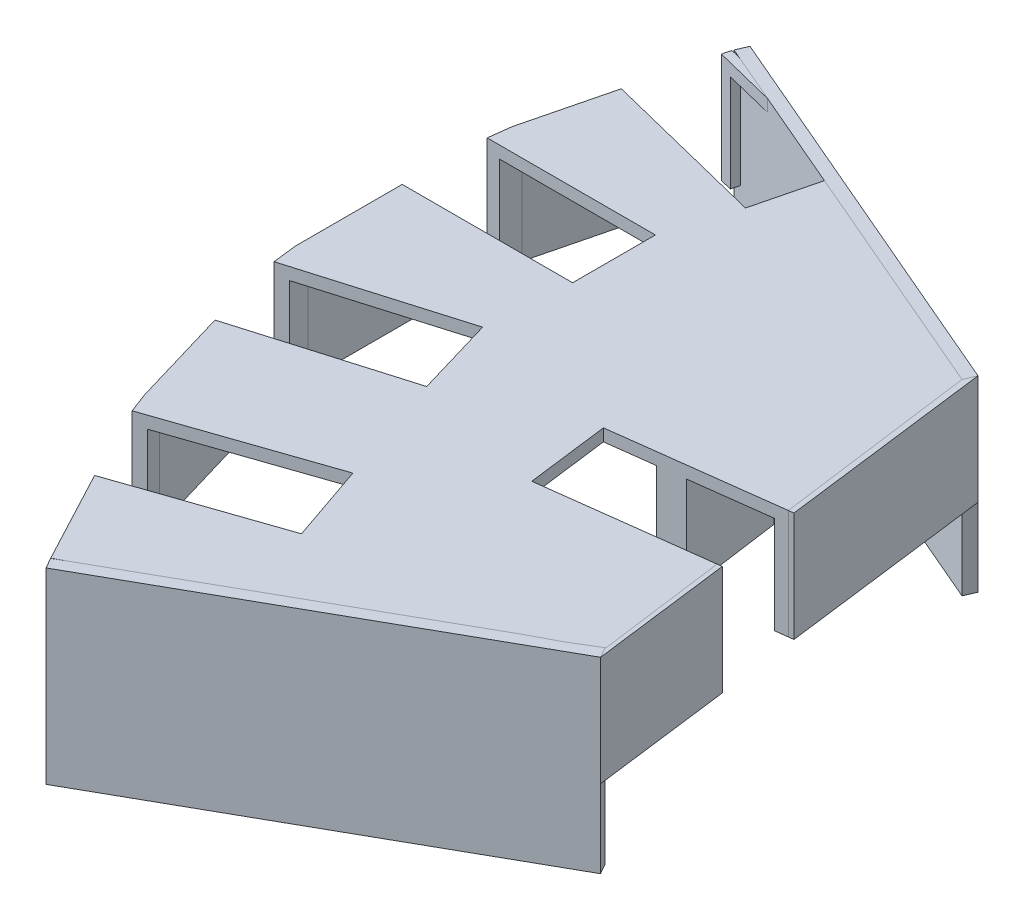
from build123d import *

# Parameters (mm, degrees)
BOSS_EXTRUDE1_DEPTH   = 20
BOSS_EXTRUDE1_2_DEPTH = 20
BOSS_EXTRUDE3_DEPTH   = 2.5
BOSS_EXTRUDE5_DEPTH   = 2.5
BOSS_EXTRUDE7_DEPTH   = 2.5
BOSS_EXTRUDE9_DEPTH   = 22.5
CUT_EXTRUDE1_DEPTH    = 35
CUT_EXTRUDE3_DEPTH    = 35
CUT_EXTRUDE5_DEPTH    = 35
CUT_EXTRUDE7_DEPTH    = 35
CUT_EXTRUDE8_DEPTH    = 35


with BuildPart() as part:
    # Sketch1 → Boss-Extrude1 (new body)
    with BuildSketch(Plane(origin=(0, 0, 0), x_dir=(1, 0, 0), z_dir=(0, 1, 0))):
        Polygon((33.151826981, -28.889539813), (43.532853036, -48.440295537), (55.01986224, -42.340943495), (43.794416361, 42.302390906), (30.631369723, 47.950055803), (24.810262555, 22.924594248), (25.109476408, 19.342716652), (25.112763078, -0.657283348), (25.762252215, -5.365269223), (31.429425892, -24.545549266), align=None)
        Polygon((32.389830977, 44.475185063), (27.334304705, 22.741024409), (43.567457043, 24.997907911), (41.502917609, 40.565173886), align=None, mode=Mode.SUBTRACT)
        Polygon((27.747419084, 19.769604461), (33.794993109, -23.728959096), (35.42478626, -27.839387317), (44.568470816, -45.059837607), (52.313182094, -40.947564368), (43.961873164, 22.023888357), align=None, mode=Mode.SUBTRACT)
    extrude(amount=BOSS_EXTRUDE1_DEPTH)



with BuildPart() as body_2:
    # Sketch1 → Boss-Extrude1 2 (new body)
    with BuildSketch(Plane(origin=(0, 0, 0), x_dir=(1, 0, 0), z_dir=(0, 1, 0))):
        Polygon((-35.959492242, 76.521167337), (-38.385231558, 77.125972076), (-47.373086859, 41.077653402), (-48.397629196, 32.789030369), (-48.391827101, -2.517800327), (-47.399088956, -10.603003688), (-37.394840102, -44.4619086), (-34.498049544, -52.008306004), (-18.012795707, -83.055253493), (-15.804757852, -81.882833418), (-32.218638907, -50.970303455), (-35.02538101, -43.658490296), (-44.942934944, -10.093000221), (-45.891852228, -2.364689129), (-45.897603901, 32.635310398), (-44.910602379, 40.620225465), align=None)
    extrude(amount=BOSS_EXTRUDE1_2_DEPTH)


with BuildPart() as part_1:
    add(part.part)

    add(body_2.part)  # Boss-Extrude3 merges body 2
    # Sketch5 → Boss-Extrude3 (add)
    with BuildSketch(Plane(origin=(0, 20, 0), x_dir=(1, 0, 0), z_dir=(0, 1, 0))):
        with BuildLine():
            Line((-15.804757852, -81.882833418), (43.532853036, -48.440295537))
            Line((43.532853036, -48.440295537), (55.01986224, -42.340943495))
            Line((55.01986224, -42.340943495), (43.794416361, 42.302390906))
            Line((43.794416361, 42.302390906), (30.631369723, 47.950055803))
            Line((30.631369723, 47.950055803), (-35.959492242, 76.521167337))
            ThreePointArc((-35.959492242, 76.521167337), (-37.147972825, 76.921388943), (-38.385231558, 77.125972076))
            Line((-38.385231558, 77.125972076), (-47.373086859, 41.077653402))
            Line((-47.373086859, 41.077653402), (-48.397629196, 32.789030369))
            Line((-48.397629196, 32.789030369), (-48.391827101, -2.517800327))
            Line((-48.391827101, -2.517800327), (-47.399088956, -10.603003688))
            Line((-47.399088956, -10.603003688), (-37.394840102, -44.4619086))
            Line((-37.394840102, -44.4619086), (-34.498049544, -52.008306004))
            Line((-34.498049544, -52.008306004), (-18.012795707, -83.055253493))
            Line((-18.012795707, -83.055253493), (-15.804757852, -81.882833418))
        make_face()
    extrude(amount=BOSS_EXTRUDE3_DEPTH)

    # Sketch9 → Cut-Extrude1 (cut)
    with BuildSketch(Plane(origin=(-42.82190598, 22.5, -75.462856003), x_dir=(0.9988636405139372, 0, -0.047659497051944756), z_dir=(0, 1, 0))):
        Polygon((0.746020724, -124.239988023), (35.312448522, -114.182052387), (40.062029239, -130.505087736), (5.495601441, -140.563023372), align=None)
    extrude(amount=-CUT_EXTRUDE1_DEPTH, mode=Mode.SUBTRACT)

    # Sketch11 → Cut-Extrude3 (cut)
    with BuildSketch(Plane(origin=(-42.82190598, 22.5, -75.462856003), x_dir=(0.9988636405139371, 0, -0.04765949705194475), z_dir=(0, 1, 0))):
        Polygon((-5.396966491, -99.162626381), (28.603046753, -90.856056728), (24.568427207, -74.341764581), (-9.431586037, -82.648334234), align=None)
    extrude(amount=-CUT_EXTRUDE3_DEPTH, mode=Mode.SUBTRACT)

    # Sketch13 → Cut-Extrude5 (cut)
    with BuildSketch(Plane(origin=(-42.82190598, 22.5, -75.462856003), x_dir=(0.9988636405139371, 0, -0.04765949705194475), z_dir=(0, 1, 0))):
        Polygon((-7.42661137, -38.645767828), (27.533889698, -40.308105066), (26.726468754, -57.28891987), (-8.234032314, -55.626582632), align=None)
    extrude(amount=-CUT_EXTRUDE5_DEPTH, mode=Mode.SUBTRACT)

    # Sketch15 → Cut-Extrude7 (cut)
    with BuildSketch(Plane(origin=(-42.82190598, 22.5, -75.462856003), x_dir=(0.9988636405139371, 0, -0.04765949705194475), z_dir=(0, 1, 0))):
        Polygon((4.020110973, -0.182810694), (16.469733166, -3.925390986), (36.510013001, -13.679647293), (32.65940268, -26.488629322), (-0.858810917, -16.412451614), align=None)
    extrude(amount=-CUT_EXTRUDE7_DEPTH, mode=Mode.SUBTRACT)


with BuildPart() as body_2_2:
    # Sketch6 → Boss-Extrude5 (new body)
    with BuildSketch(Plane(origin=(31.213867564, 0, 55.383246764), x_dir=(0.871166636126556, 0, -0.4909874663369126), z_dir=(0.49098746633691265, 0, 0.8711666361265561))):
        Polygon((-53.972022649, 22.5), (14.140791166, 22.5), (27.142595739, 22.5), (27.142595739, 0), (27.142595739, -16), (-56.471235122, -16), (-56.471235122, 0), (-56.471235122, 22.5), align=None)
    extrude(amount=BOSS_EXTRUDE5_DEPTH)


with BuildPart() as body_3:
    # Sketch7 → Boss-Extrude7 (new body)
    with BuildSketch(Plane(origin=(22.136914585, 0, -51.594640331), x_dir=(-0.9189842056612053, 0, -0.3942943440441967), z_dir=(0.3942943440441968, 0, -0.9189842056612054))):
        Polygon((-23.566783458, 0), (-23.566783458, 22.5), (65.685756101, 22.5), (65.685756101, 0), (65.685756101, -16), (-23.566783458, -16), align=None)
    extrude(amount=BOSS_EXTRUDE7_DEPTH)


with BuildPart() as body_4:
    # Sketch8 → Boss-Extrude9 (new body)
    with BuildSketch(Plane.XZ):
        Polygon((56.087060055, 44.234489043), (44.780152221, -44.59985142), (43.794416361, -42.302390906), (55.01986224, 42.340943495), align=None)
    extrude(amount=-BOSS_EXTRUDE9_DEPTH)


with BuildPart() as cut_extrude7_piece_1:
    # of the separate pieces the step leaves, piece 1, a body of its own (cut_extrude7_pieces)
    add(part_1.part.solids().sort_by_distance((33.151826981, 0, 28.889539813))[0])


with BuildPart() as cut_extrude7_piece_2:
    # of the separate pieces the step leaves, piece 2, a body of its own (cut_extrude7_pieces)
    add(part_1.part.solids().sort_by_distance((-36.371911317, 20, -74.867044776))[0])


with BuildPart() as cut_extrude8_tool:
    # Sketch16 → Cut-Extrude8 (new body)
    with BuildSketch(Plane(origin=(-42.82190598, 22.5, -75.462856003), x_dir=(0.9988636405139371, 0, -0.04765949705194475), z_dir=(0, 1, 0))):
        Polygon((54.582299423, -81.281151066), (89.473352578, -78.521729075), (90.81364326, -95.468812036), (55.922590105, -98.228234027), align=None)
    extrude(amount=-CUT_EXTRUDE8_DEPTH)


with BuildPart() as body_4_1:
    add(body_4.part)

    # Cut-Extrude8: cut by cut_extrude8_tool
    add(cut_extrude8_tool.part, mode=Mode.SUBTRACT)


with BuildPart() as cut_extrude7_piece_1_1:
    add(cut_extrude7_piece_1.part)

    # Cut-Extrude8: cut by cut_extrude8_tool
    add(cut_extrude8_tool.part, mode=Mode.SUBTRACT)


solid = Compound([body_2_2.part, body_3.part, cut_extrude7_piece_2.part, body_4_1.part, cut_extrude7_piece_1_1.part])
